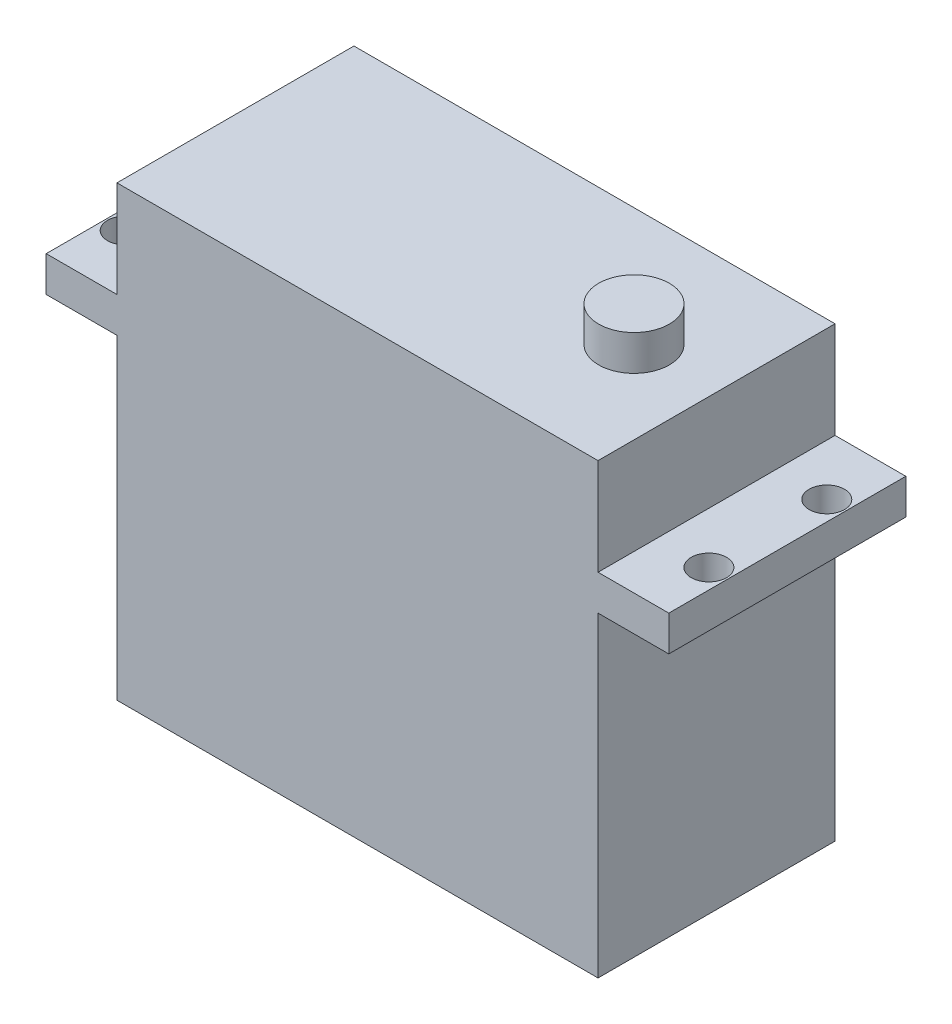
from build123d import *

# Parameters (mm, degrees)
BOSS_EXTRUDE1_DEPTH = 20.1
SKETCH2_R           = 3
BOSS_EXTRUDE2_DEPTH = 3
CUT_EXTRUDE1_REACH  = 61.011
SKETCH3_R           = 1.5


with BuildPart() as part:
    # Sketch1 → Boss-Extrude1 (new body)
    with BuildSketch(Plane.XY):
        Polygon((0, 0), (40.8, 0), (40.8, 26.8), (46.8, 26.8), (46.8, 29.8), (40.8, 29.8), (40.8, 38), (0, 38), (0, 29.8), (-6, 29.8), (-6, 26.8), (0, 26.8), align=None)
    extrude(amount=BOSS_EXTRUDE1_DEPTH)

    # Sketch2 → Boss-Extrude2 (add)
    with BuildSketch(Plane(origin=(0, 38, 0), x_dir=(1, 0, 0), z_dir=(0, 1, 0))):
        with Locations((33.8, -10.05)):
            Circle(SKETCH2_R)
    extrude(amount=BOSS_EXTRUDE2_DEPTH)

    # Sketch3 → Cut-Extrude1 (cut, up to next)
    with BuildSketch(Plane(origin=(0, 29.8, 0), x_dir=(1, 0, 0), z_dir=(0, 1, 0)), mode=Mode.PRIVATE) as cut_extrude1_sk1:
        with Locations(Location((45.15, -15.05, 0), (0, 0, 270))):
            Circle(SKETCH3_R)
    cut_extrude1_tool1 = extrude(cut_extrude1_sk1.sketch, amount=-CUT_EXTRUDE1_REACH, mode=Mode.PRIVATE) & part.part
    # Sketch3 → Cut-Extrude1 (cut, up to next)
    with BuildSketch(Plane(origin=(0, 29.8, 0), x_dir=(1, 0, 0), z_dir=(0, 1, 0)), mode=Mode.PRIVATE) as cut_extrude1_sk2:
        with Locations(Location((45.15, -5.05, 0), (0, 0, 270))):
            Circle(SKETCH3_R)
    cut_extrude1_tool2 = extrude(cut_extrude1_sk2.sketch, amount=-CUT_EXTRUDE1_REACH, mode=Mode.PRIVATE) & part.part
    # Sketch3 → Cut-Extrude1 (cut, up to next)
    with BuildSketch(Plane(origin=(0, 29.8, 0), x_dir=(1, 0, 0), z_dir=(0, 1, 0)), mode=Mode.PRIVATE) as cut_extrude1_sk3:
        with Locations(Location((-4.35, -5.05, 0), (0, 0, 270))):
            Circle(SKETCH3_R)
    cut_extrude1_tool3 = extrude(cut_extrude1_sk3.sketch, amount=-CUT_EXTRUDE1_REACH, mode=Mode.PRIVATE) & part.part
    # Sketch3 → Cut-Extrude1 (cut, up to next)
    with BuildSketch(Plane(origin=(0, 29.8, 0), x_dir=(1, 0, 0), z_dir=(0, 1, 0)), mode=Mode.PRIVATE) as cut_extrude1_sk4:
        with Locations(Location((-4.35, -15.05, 0), (0, 0, 270))):
            Circle(SKETCH3_R)
    cut_extrude1_tool4 = extrude(cut_extrude1_sk4.sketch, amount=-CUT_EXTRUDE1_REACH, mode=Mode.PRIVATE) & part.part
    add(cut_extrude1_tool1.solids().sort_by_distance((45.15, 29.8, 15.05))[0], mode=Mode.SUBTRACT)
    add(cut_extrude1_tool2.solids().sort_by_distance((45.15, 29.8, 5.05))[0], mode=Mode.SUBTRACT)
    add(cut_extrude1_tool3.solids().sort_by_distance((-4.35, 29.8, 5.05))[0], mode=Mode.SUBTRACT)
    add(cut_extrude1_tool4.solids().sort_by_distance((-4.35, 29.8, 15.05))[0], mode=Mode.SUBTRACT)


solid = part.part
